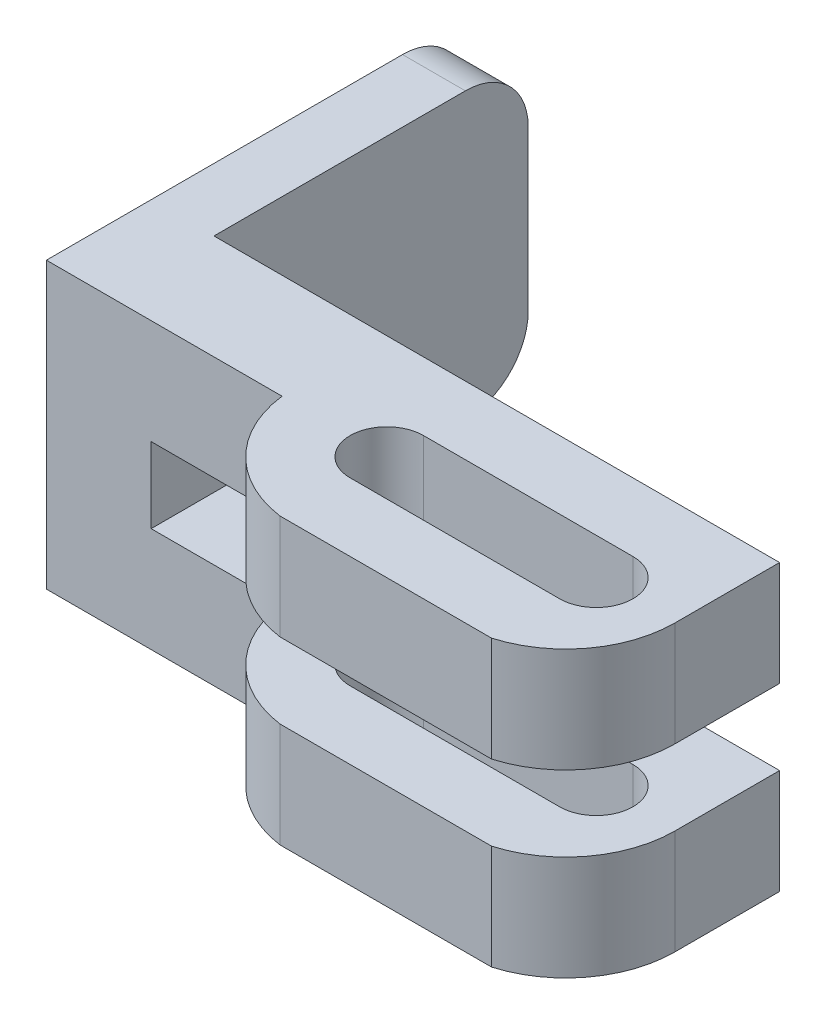
from build123d import *

# Parameters (mm, degrees)
SALIENTE_EXTRUIR1_DEPTH = 10
CORTAR_EXTRUIR1_DEPTH   = 92.569427212
CROQUIS3_W              = 3
CROQUIS3_H              = 13.6
SALIENTE_EXTRUIR2_DEPTH = 15
CHAFL_N1_SIZE           = 10
CHAFL_N1_SIZE2          = 2.679491924
REDONDEO1_R             = 3
CROQUIS4_W              = 167.371615842
CROQUIS4_H              = 49.121487425
CORTAR_EXTRUIR2_DEPTH   = 93.249444443


with BuildPart() as part:
    # Croquis1 → Saliente-Extruir1 (new body)
    with BuildSketch(Plane.XY):
        Polygon((-90, -6.8), (-90, -1.8), (-65, -1.8), (-65, 1.8), (-90, 1.8), (-90, 6.8), (90, 6.8), (90, 1.8), (65, 1.8), (65, -1.8), (90, -1.8), (90, -6.8), align=None)
    extrude(amount=SALIENTE_EXTRUIR1_DEPTH)

    # Croquis2 → Cortar-Extruir1 (cut, through all)
    with BuildSketch(Plane(origin=(0, 6.8, 0), x_dir=(1, 0, 0), z_dir=(0, 1, 0))):
        with BuildLine():
            Line((-76.25, -3.25), (-86.25, -3.25))
            ThreePointArc((-86.25, -3.25), (-88, -5), (-86.25, -6.75))
            Line((-86.25, -6.75), (-76.25, -6.75))
            ThreePointArc((-76.25, -6.75), (-74.5, -5), (-76.25, -3.25))
        make_face()
        with BuildLine():
            ThreePointArc((-90, -5), (-88.958333333, -1.875), (-86.25, 0))
            Line((-86.25, 0), (-90, 0))
            Line((-90, 0), (-90, -5))
        make_face()
        with BuildLine():
            Line((86.25, -10), (90, -10))
            Line((90, -10), (90, -5))
            ThreePointArc((90, -5), (88.958333333, -8.125), (86.25, -10))
        make_face()
        with BuildLine():
            Line((76.25, -6.75), (86.25, -6.75))
            ThreePointArc((86.25, -6.75), (88, -5), (86.25, -3.25))
            Line((86.25, -3.25), (76.25, -3.25))
            ThreePointArc((76.25, -3.25), (74.5, -5), (76.25, -6.75))
        make_face()
        with BuildLine():
            Line((71.25, -5), (-71.25, -5))
            ThreePointArc((-71.25, -5), (-72.847588014, -8.335363746), (-76.15, -10))
            Line((-76.15, -10), (76.15, -10))
            ThreePointArc((76.15, -10), (72.847588014, -8.335363746), (71.25, -5))
        make_face()
    extrude(amount=-CORTAR_EXTRUIR1_DEPTH, mode=Mode.SUBTRACT)

    # Croquis3 → Saliente-Extruir2 (add)
    with BuildSketch(Plane(origin=(0, 0, 0), x_dir=(-1, 0, 0), z_dir=(0, 0, -1))):
        with Locations((-61.5, 0)):
            Rectangle(CROQUIS3_W, CROQUIS3_H)
        with Locations((61.5, 0)):
            Rectangle(CROQUIS3_W, CROQUIS3_H)
    extrude(amount=SALIENTE_EXTRUIR2_DEPTH)

    # Chaflán1
    chafl_n1_edges = [part.edges().sort_by_distance(p)[0] for p in [
        (0, -6.8, 0),
    ]]
    chafl_n1_side = [part.faces().sort_by_distance(p)[0] for p in [
        (0, 0, 0),
    ]]
    chamfer(chafl_n1_edges, length=CHAFL_N1_SIZE, length2=CHAFL_N1_SIZE2, reference=chafl_n1_side[0])

    # Redondeo1
    redondeo1_edges = [part.edges().sort_by_distance(p)[0] for p in [
        (61.5, 6.8, -15),
        (61.5, -6.8, -15),
        (-61.5, 6.8, -15),
        (-61.5, -6.8, -15),
    ]]
    fillet(redondeo1_edges, radius=REDONDEO1_R)

    # Croquis4 → Cortar-Extruir2 (cut, through all)
    with BuildSketch(Plane(origin=(0, -6.8, 0), x_dir=(-1, 0, 0), z_dir=(0, -1, 0))):
        with Locations((23.685807921, 0.224960459)):
            Rectangle(CROQUIS4_W, CROQUIS4_H)
    extrude(amount=-CORTAR_EXTRUIR2_DEPTH, mode=Mode.SUBTRACT)


solid = part.part
